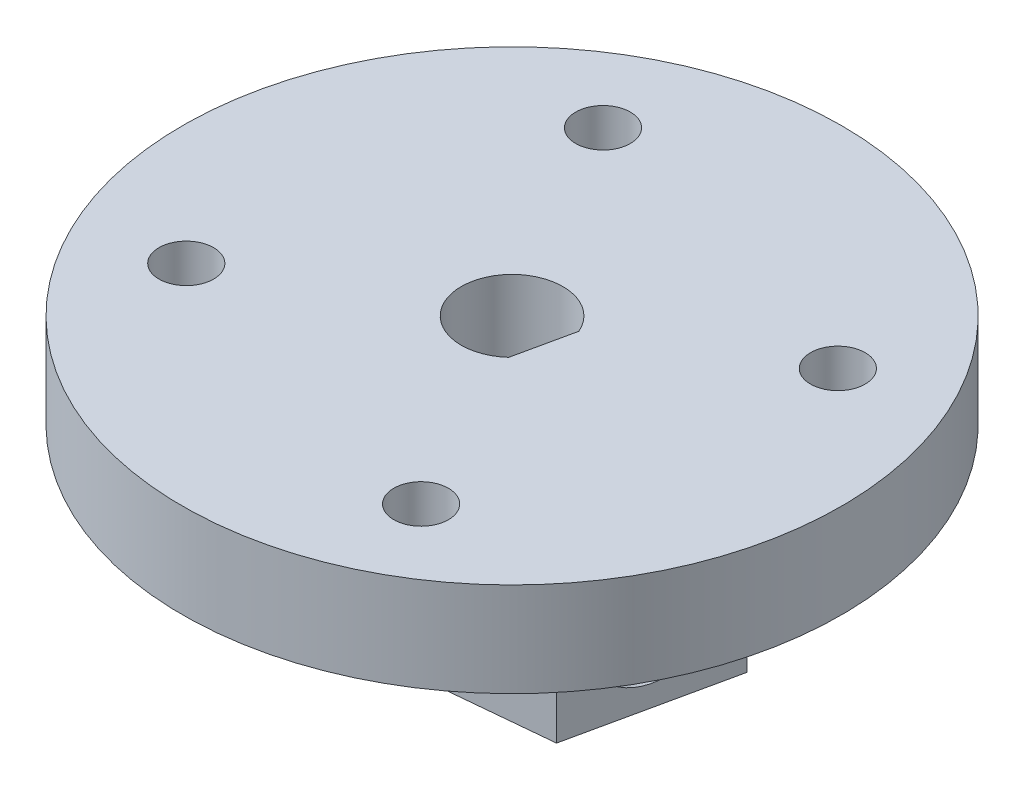
from build123d import *

# Parameters (mm, degrees)
SKETCH1_R           = 17.5
SKETCH1_R_2         = 1.45
BOSS_EXTRUDE1_DEPTH = 5
BOSS_EXTRUDE2_DEPTH = 6.25
CUT_EXTRUDE1_DEPTH  = 7
CUT_EXTRUDE2_DEPTH  = 5.85
BOSS_EXTRUDE3_START = 2
SKETCH5_W           = 6.504597346
SKETCH5_H           = 6.25
SKETCH5_R           = 1.7
BOSS_EXTRUDE3_DEPTH = 2
SKETCH6_R           = 3
CUT_EXTRUDE3_DEPTH  = 1.5
BOSS_EXTRUDE4_START = 1.5
SKETCH7_W           = 6.508151024
SKETCH7_H           = 6.25
SKETCH7_R           = 3
BOSS_EXTRUDE4_DEPTH = 1.5
BOSS_EXTRUDE5_START = -6.25
BOSS_EXTRUDE5_DEPTH = 6.25
BOSS_EXTRUDE6_DEPTH = 1


with BuildPart() as part:
    # Sketch1 → Boss-Extrude1 (new body)
    with BuildSketch(Plane.XZ.offset(-15)):
        with Locations(Location((0, 0, 0), (0, 0, 270))):
            Circle(SKETCH1_R)
        with Locations(Location((-6.234624063, -11.064332912, 0), (0, 0, 270))):
            Circle(SKETCH1_R_2, mode=Mode.SUBTRACT)
        with Locations(Location((11.064332912, -6.234624063, 0), (0, 0, 270))):
            Circle(SKETCH1_R_2, mode=Mode.SUBTRACT)
        with Locations(Location((-11.064332912, 6.234624063, 0), (0, 0, 270))):
            Circle(SKETCH1_R_2, mode=Mode.SUBTRACT)
        with BuildLine():
            ThreePointArc((2.481687642, -1.063591298), (-2.638702415, -0.572057308), (1.818419998, 1.995832837))
            Line((1.818419998, 1.995832837), (1.856473873, 1.82030348))
            Line((1.856473873, 1.82030348), (2.443633767, -0.888061941))
            Line((2.443633767, -0.888061941), (2.481687642, -1.063591298))
        make_face(mode=Mode.SUBTRACT)
        with Locations(Location((6.234624063, 11.064332912, 0), (0, 0, 270))):
            Circle(SKETCH1_R_2, mode=Mode.SUBTRACT)
    extrude(amount=BOSS_EXTRUDE1_DEPTH)

    # Sketch2 → Boss-Extrude2 (add)
    with BuildSketch(Plane.XZ.offset(-10)):
        with BuildLine():
            Line((6.747748589, -1.862226887), (6.059242583, 1.313613078))
            Line((6.059242583, 1.313613078), (5.370736577, 4.489453042))
            ThreePointArc((5.370736577, 4.489453042), (-5.837040783, 3.863800576), (-2.034603986, -6.697789682))
            ThreePointArc((-2.034603986, -6.697789682), (-1.550245392, -6.826180427), (-1.05794298, -6.919592232))
            ThreePointArc((-1.05794298, -6.919592232), (1.483111539, -6.841080336), (3.828542975, -5.860226846))
            ThreePointArc((3.828542975, -5.860226846), (4.323739448, -5.505022905), (4.786164678, -5.108094329))
            ThreePointArc((4.786164678, -5.108094329), (5.990968426, -3.620538264), (6.747748589, -1.862226887))
        make_face()
        with BuildLine():
            ThreePointArc((2.481687642, -1.063591298), (-2.638702415, -0.572057308), (1.818419998, 1.995832837))
            Line((1.818419998, 1.995832837), (2.481687642, -1.063591298))
        make_face(mode=Mode.SUBTRACT)
    extrude(amount=BOSS_EXTRUDE2_DEPTH)

    # Sketch3 → Cut-Extrude1 (cut)
    with BuildSketch(Plane(origin=(6.059242583, 0, 1.313613078), x_dir=(0.21187307702941563, 0, -0.9772971908432395), z_dir=(0.9772971908432395, 0, 0.21187307702941563))):
        with BuildLine():
            ThreePointArc((0, 8.575), (-1.7, 6.875), (0, 5.175))
            Line((0, 5.175), (0, 8.575))
        make_face()
        with BuildLine():
            Line((0, 8.575), (0, 5.175))
            ThreePointArc((0, 5.175), (1.202081528, 5.672918472), (1.7, 6.875))
            ThreePointArc((1.7, 6.875), (1.202081528, 8.077081528), (0, 8.575))
        make_face()
    extrude(amount=-CUT_EXTRUDE1_DEPTH, mode=Mode.SUBTRACT)

    # Sketch4 → Cut-Extrude2 (cut)
    with BuildSketch(Plane.XZ.offset(-3.75)):
        Polygon((3.620479073, -2.540596639), (4.793235702, -2.286348947), (6.161451769, -1.989726639), (4.784276768, 4.362705102), (2.243304072, 3.811835101), align=None)
    extrude(amount=-CUT_EXTRUDE2_DEPTH, mode=Mode.SUBTRACT)

    # Sketch5 → Boss-Extrude3 (add)
    with BuildSketch(Plane(origin=(6.059242583, 0, 1.313613078), x_dir=(0.21187307702941563, 0, -0.9772971908432395), z_dir=(0.9772971908432395, 0, 0.21187307702941563)).offset(BOSS_EXTRUDE3_START)):
        with Locations((-0.002683311, 6.875)):
            Rectangle(SKETCH5_W, SKETCH5_H)
        with Locations((0, 6.875)):
            Circle(SKETCH5_R, mode=Mode.SUBTRACT)
    extrude(amount=-BOSS_EXTRUDE3_DEPTH)

    # Sketch6 → Cut-Extrude3 (cut)
    with BuildSketch(Plane(origin=(8.013836965, 0, 1.737359232), x_dir=(0.21187307702941569, 0, -0.9772971908432395), z_dir=(0.9772971908432395, 0, 0.21187307702941569))):
        with Locations((0, 6.875)):
            Circle(SKETCH6_R)
    extrude(amount=-CUT_EXTRUDE3_DEPTH, mode=Mode.SUBTRACT)

    # Sketch7 → Boss-Extrude4 (add)
    with BuildSketch(Plane(origin=(8.013836965, 0, 1.737359232), x_dir=(0.21187307702941569, 0, -0.9772971908432395), z_dir=(0.9772971908432395, 0, 0.21187307702941569)).offset(BOSS_EXTRUDE4_START)):
        with Locations((-0.00446015, 6.875)):
            Rectangle(SKETCH7_W, SKETCH7_H)
        with Locations((0, 6.875)):
            Circle(SKETCH7_R, mode=Mode.SUBTRACT)
    extrude(amount=-BOSS_EXTRUDE4_DEPTH)

    # Sketch8 → Boss-Extrude5 (add)
    with BuildSketch(Plane.XZ.offset(-3.75).offset(BOSS_EXTRUDE5_START)):
        with BuildLine():
            Line((8.789386774, 5.239726596), (8.577513697, 6.217023787))
            Line((8.577513697, 6.217023787), (0.69957596, 6.964954664))
            ThreePointArc((0.69957596, 6.964954664), (3.27783475, 6.185127271), (5.370736577, 4.489453042))
            Line((5.370736577, 4.489453042), (5.369599535, 4.494697826))
            Line((5.369599535, 4.494697826), (7.324193916, 4.91844398))
            Line((7.324193916, 4.91844398), (7.323440988, 4.921916981))
            Line((7.323440988, 4.921916981), (8.789386774, 5.239726596))
        make_face()
        with BuildLine():
            ThreePointArc((6.747748589, -1.862226887), (5.549511662, -4.266488053), (3.533996626, -6.042422349))
            Line((3.533996626, -6.042422349), (10.380161834, -2.097968308))
            Line((10.380161834, -2.097968308), (10.168288757, -1.120671117))
            Line((10.168288757, -1.120671117), (6.747748589, -1.862226887))
        make_face()
    extrude(amount=BOSS_EXTRUDE5_DEPTH)

    # Sketch10 → Boss-Extrude6 (add)
    with BuildSketch(Plane.XZ.offset(-3.75)):
        with BuildLine():
            Line((8.577513697, 6.217023787), (0.69957596, 6.964954664))
            ThreePointArc((0.69957596, 6.964954664), (-6.839499134, -1.490386391), (3.533996626, -6.042422349))
            Line((3.533996626, -6.042422349), (10.380161834, -2.097968308))
            Line((10.380161834, -2.097968308), (8.577513697, 6.217023787))
        make_face()
        Polygon((6.161451769, -1.989726639), (3.620479073, -2.540596639), (2.243304072, 3.811835101), (4.784276768, 4.362705102), align=None, mode=Mode.SUBTRACT)
        with BuildLine():
            Line((1.818419998, 1.995832837), (2.481687642, -1.063591298))
            ThreePointArc((2.481687642, -1.063591298), (-2.638702415, -0.572057308), (1.818419998, 1.995832837))
        make_face(mode=Mode.SUBTRACT)
    extrude(amount=BOSS_EXTRUDE6_DEPTH)


solid = part.part
